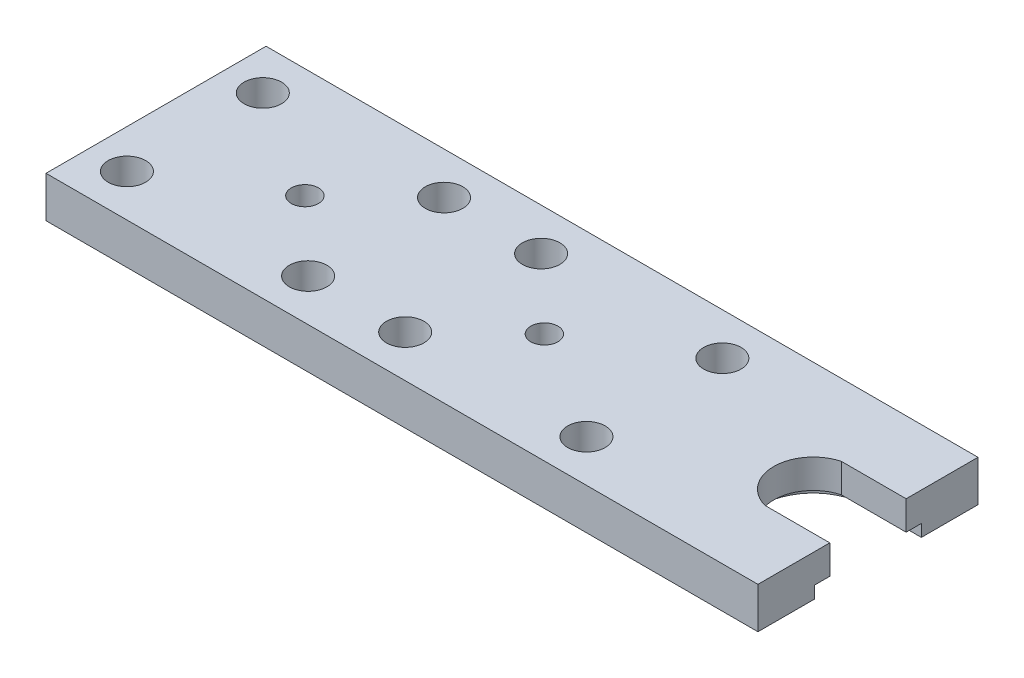
from build123d import *

# Parameters (mm, degrees)
SKETCH1_W                   = 110
SKETCH1_H                   = 34
BOSS_EXTRUDE1_DEPTH         = 6.35
M5_CLEARANCE_HOLE1_D        = 5.8
TAP_DRILL_FOR_M5X0_8_TAP1_D = 4.2
CUT_EXTRUDE1_DEPTH          = 77.299230009
CUT_EXTRUDE2_DEPTH          = 1.87


with BuildPart() as part:
    # Sketch1 → Boss-Extrude1 (new body)
    with BuildSketch(Plane.XZ):
        with Locations((13.5, 16)):
            Rectangle(SKETCH1_W, SKETCH1_H)
    extrude(amount=-BOSS_EXTRUDE1_DEPTH)

    # M5 Clearance Hole1 (through all)
    with Locations(Plane(origin=(0, 6.35, 0), x_dir=(1, 0, 0), z_dir=(0, 1, 0))):
        with Locations((-35.5, -5.5), (-7.5, -5.5), (7.5, -5.5), (35.5, -5.5), (-35.5, -26.5), (-7.5, -26.5), (7.5, -26.5), (35.5, -26.5)):
            Hole(M5_CLEARANCE_HOLE1_D / 2)

    # Tap Drill for M5x0.8 Tap1 (through all)
    with Locations(Plane(origin=(0, 6.35, 0), x_dir=(1, 0, 0), z_dir=(0, 1, 0))):
        with Locations((-18.5, -16), (18.5, -16)):
            Hole(TAP_DRILL_FOR_M5X0_8_TAP1_D / 2)

    # Sketch9 → Cut-Extrude1 (cut, through all)
    with BuildSketch(Plane(origin=(0, 6.35, 0), x_dir=(1, 0, 0), z_dir=(0, 1, 0))):
        with BuildLine():
            Line((68.5, -10.1), (58.5, -10.1))
            ThreePointArc((58.5, -10.1), (53.949193338, -16), (58.5, -21.9))
            Line((58.5, -21.9), (68.5, -21.9))
            Line((68.5, -21.9), (68.5, -10.1))
        make_face()
    extrude(amount=-CUT_EXTRUDE1_DEPTH, mode=Mode.SUBTRACT)

    # Sketch10 → Cut-Extrude2 (cut)
    with BuildSketch(Plane(origin=(0, 0, 0), x_dir=(1, 0, 0), z_dir=(0, 1, 0))):
        with BuildLine():
            Line((68.5, -24.25), (60.049193338, -24.25))
            ThreePointArc((60.049193338, -24.25), (51.799193338, -16), (60.049193338, -7.75))
            Line((60.049193338, -7.75), (68.5, -7.75))
            Line((68.5, -7.75), (68.5, -24.25))
        make_face()
    extrude(amount=CUT_EXTRUDE2_DEPTH, mode=Mode.SUBTRACT)


solid = part.part
